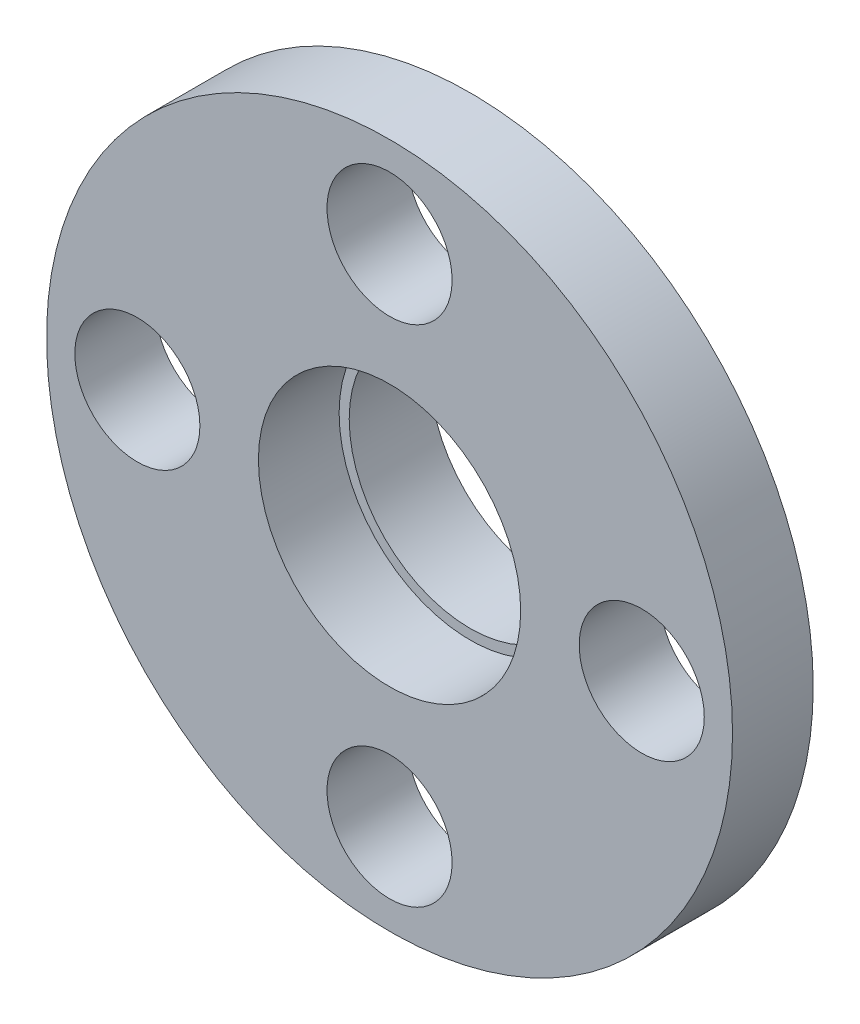
from build123d import *

# Parameters (mm, degrees)
SKETCH_1_R      = 3.25
SKETCH_1_R_2    = 3
EXTRUDE_3_DEPTH = 2
SKETCH_3_R      = 8.5
SKETCH_3_R_2    = 1.55
SKETCH_3_R_3    = 3.25
EXTRUDE_4_DEPTH = 2


with BuildPart() as part:
    # 草图1 → 凸台-拉伸3 (new body)
    with BuildSketch(Plane.XY):
        Circle(SKETCH_1_R)
        Circle(SKETCH_1_R_2, mode=Mode.SUBTRACT)
    extrude(amount=EXTRUDE_3_DEPTH)


with BuildPart() as body_2:
    # 草图3 → 凸台-拉伸4 (new body)
    with BuildSketch(Plane.XY.offset(2)):
        Circle(SKETCH_3_R)
        with Locations((0, 6.25)):
            Circle(SKETCH_3_R_2, mode=Mode.SUBTRACT)
        with Locations((-6.25, 0)):
            Circle(SKETCH_3_R_2, mode=Mode.SUBTRACT)
        with Locations((0, -6.25)):
            Circle(SKETCH_3_R_2, mode=Mode.SUBTRACT)
        with Locations((6.25, 0)):
            Circle(SKETCH_3_R_2, mode=Mode.SUBTRACT)
        Circle(SKETCH_3_R_3, mode=Mode.SUBTRACT)
    extrude(amount=EXTRUDE_4_DEPTH)


solid = Compound([part.part, body_2.part])
